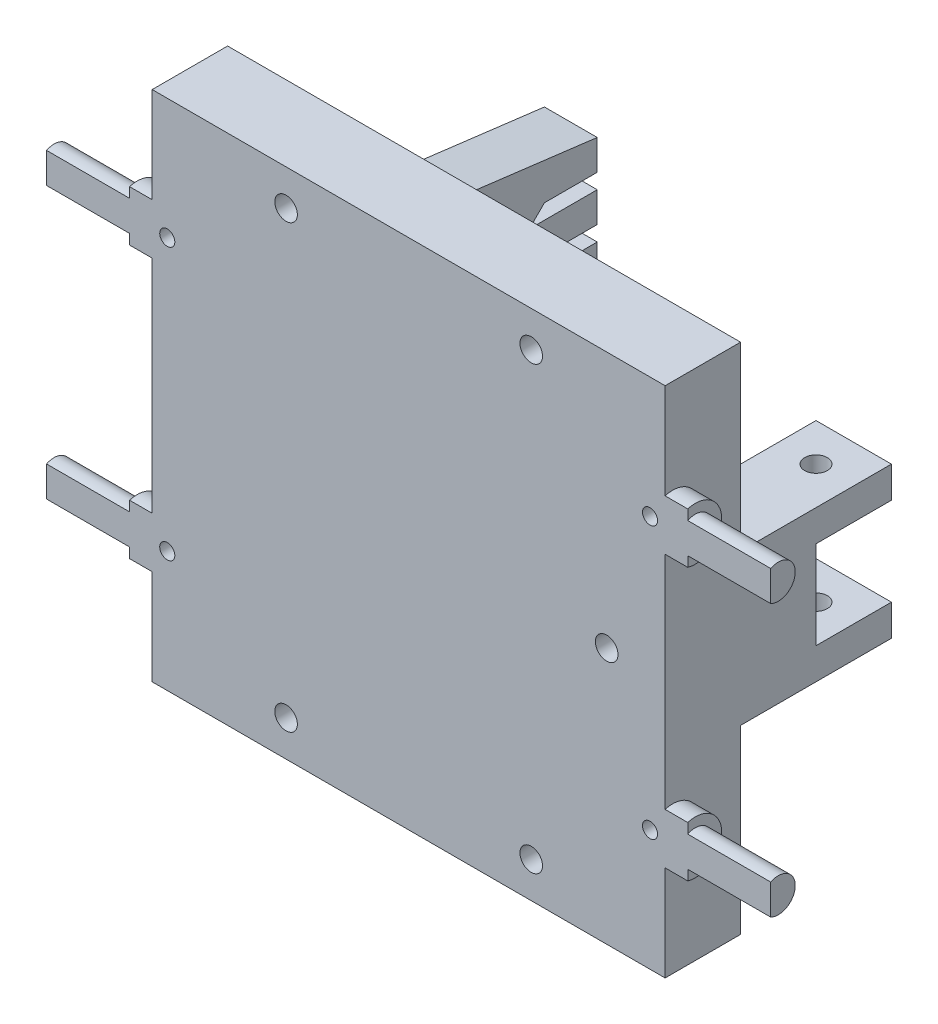
from build123d import *

# Parameters (mm, degrees)
SKETCH1_W           = 68
SKETCH1_H           = 68
BOSS_EXTRUDE1_DEPTH = 10
BOSS_EXTRUDE2_DEPTH = 3
BOSS_EXTRUDE3_DEPTH = 11
BOSS_EXTRUDE4_START = 3
BOSS_EXTRUDE4_DEPTH = 3
BOSS_EXTRUDE5_START = 11
BOSS_EXTRUDE5_DEPTH = 11
SKETCH6_W           = 42.5
SKETCH6_H           = 42.5
CUT_EXTRUDE1_DEPTH  = 3
SKETCH8_R           = 1.5
CUT_EXTRUDE2_DEPTH  = 15
SKETCH9_W           = 10
SKETCH9_H           = 20
BOSS_EXTRUDE6_DEPTH = 20
SKETCH10_R          = 1.5
CUT_EXTRUDE3_DEPTH  = 10
SKETCH11_R          = 1
CUT_EXTRUDE4_DEPTH  = 20
SKETCH13_W          = 7
SKETCH13_H          = 16
BOSS_EXTRUDE7_DEPTH = 40
CUT_EXTRUDE5_DEPTH  = 10
BOSS_EXTRUDE8_START = -7
BOSS_EXTRUDE8_DEPTH = 7
SKETCH17_W          = 10
SKETCH17_H          = 11.7
CUT_EXTRUDE6_DEPTH  = 10
SKETCH18_R          = 1.5
CUT_EXTRUDE7_DEPTH  = 30


with BuildPart() as part:
    # Sketch1 → Boss-Extrude1 (new body)
    with BuildSketch(Plane.XY):
        with Locations((-34, -34)):
            Rectangle(SKETCH1_W, SKETCH1_H)
    extrude(amount=BOSS_EXTRUDE1_DEPTH)

    # Sketch2 → Boss-Extrude2 (add)
    with BuildSketch(Plane.ZY.offset(68)):
        with BuildLine():
            Line((10, -19.354101966), (10, -12.645898034))
            ThreePointArc((10, -12.645898034), (5.5, -16), (10, -19.354101966))
        make_face()
        with BuildLine():
            Line((10, -55.354101966), (10, -48.645898034))
            ThreePointArc((10, -48.645898034), (5.5, -52), (10, -55.354101966))
        make_face()
    extrude(amount=BOSS_EXTRUDE2_DEPTH)

    # Sketch3 → Boss-Extrude3 (add)
    with BuildSketch(Plane.ZY.offset(71)):
        with BuildLine():
            ThreePointArc((10, -49.984435563), (6.75, -52), (10, -54.015564437))
            Line((10, -54.015564437), (10, -49.984435563))
        make_face()
        with BuildLine():
            ThreePointArc((10, -13.984435563), (6.75, -16), (10, -18.015564437))
            Line((10, -18.015564437), (10, -13.984435563))
        make_face()
    extrude(amount=BOSS_EXTRUDE3_DEPTH)

    # Sketch4 → Boss-Extrude4 (add)
    with BuildSketch(Plane(origin=(0, 0, 0), x_dir=(0, 0, -1), z_dir=(1, 0, 0)).offset(BOSS_EXTRUDE4_START)):
        with BuildLine():
            ThreePointArc((-5.5, -16), (-6.908349934, -13.19375696), (-10, -12.645898034))
            Line((-10, -12.645898034), (-10, -19.354101966))
            ThreePointArc((-10, -19.354101966), (-6.908349934, -18.80624304), (-5.5, -16))
        make_face()
        with BuildLine():
            ThreePointArc((-5.5, -52), (-6.908349934, -49.19375696), (-10, -48.645898034))
            Line((-10, -48.645898034), (-10, -55.354101966))
            ThreePointArc((-10, -55.354101966), (-6.908349934, -54.80624304), (-5.5, -52))
        make_face()
    extrude(amount=-BOSS_EXTRUDE4_DEPTH)

    # Sketch5 → Boss-Extrude5 (add)
    with BuildSketch(Plane(origin=(3, 0, 0), x_dir=(0, 0, -1), z_dir=(1, 0, 0)).offset(BOSS_EXTRUDE5_START)):
        with BuildLine():
            ThreePointArc((-6.75, -16), (-7.814145877, -14.087867682), (-10, -13.984435563))
            Line((-10, -13.984435563), (-10, -18.015564437))
            ThreePointArc((-10, -18.015564437), (-7.814145877, -17.912132318), (-6.75, -16))
        make_face()
        with BuildLine():
            ThreePointArc((-6.75, -52), (-7.814145877, -50.087867682), (-10, -49.984435563))
            Line((-10, -49.984435563), (-10, -54.015564437))
            ThreePointArc((-10, -54.015564437), (-7.814145877, -53.912132318), (-6.75, -52))
        make_face()
    extrude(amount=-BOSS_EXTRUDE5_DEPTH)

    # Sketch6 → Cut-Extrude1 (cut)
    with BuildSketch(Plane(origin=(0, 0, 0), x_dir=(-1, 0, 0), z_dir=(0, 0, -1))):
        with Locations((34, -34)):
            Rectangle(SKETCH6_W, SKETCH6_H)
    extrude(amount=-CUT_EXTRUDE1_DEPTH, mode=Mode.SUBTRACT)

    # Sketch8 → Cut-Extrude2 (cut)
    with BuildSketch(Plane(origin=(0, 0, 0), x_dir=(-1, 0, 0), z_dir=(0, 0, -1))):
        with Locations((17.75, -4.75)):
            Circle(SKETCH8_R)
        with Locations((50.25, -4.75)):
            Circle(SKETCH8_R)
        with Locations((50.25, -63.25)):
            Circle(SKETCH8_R)
        with Locations((17.75, -63.25)):
            Circle(SKETCH8_R)
    extrude(amount=-CUT_EXTRUDE2_DEPTH, mode=Mode.SUBTRACT)

    # Sketch9 → Boss-Extrude6 (add)
    with BuildSketch(Plane(origin=(0, 0, 0), x_dir=(-1, 0, 0), z_dir=(0, 0, -1))):
        with Locations((5, -34)):
            Rectangle(SKETCH9_W, SKETCH9_H)
    extrude(amount=BOSS_EXTRUDE6_DEPTH)

    # Sketch10 → Cut-Extrude3 (cut)
    with BuildSketch(Plane(origin=(0, 0, 0), x_dir=(-1, 0, 0), z_dir=(0, 0, -1))):
        with Locations((7.75, -34)):
            Circle(SKETCH10_R)
        with Locations((7.75, -78)):
            Circle(SKETCH10_R)
    extrude(amount=-CUT_EXTRUDE3_DEPTH, mode=Mode.SUBTRACT)

    # Sketch11 → Cut-Extrude4 (cut)
    with BuildSketch(Plane.XY.offset(10)):
        with Locations((-66, -52)):
            Circle(SKETCH11_R)
        with Locations(Location((-66, -16, 0), (0, 0, 180))):
            Circle(SKETCH11_R)
        with Locations(Location((-2, -52, 0), (0, 0, 180))):
            Circle(SKETCH11_R)
        with Locations((-2, -16)):
            Circle(SKETCH11_R)
    extrude(amount=-CUT_EXTRUDE4_DEPTH, mode=Mode.SUBTRACT)

    # Sketch13 → Boss-Extrude7 (add)
    with BuildSketch(Plane(origin=(0, 0, 0), x_dir=(-1, 0, 0), z_dir=(0, 0, -1))):
        with Locations((62.5, -34)):
            Rectangle(SKETCH13_W, SKETCH13_H)
    extrude(amount=BOSS_EXTRUDE7_DEPTH)

    # Sketch15 → Cut-Extrude5 (cut)
    with BuildSketch(Plane.ZY.offset(66)):
        Polygon((-40, -32), (-31, -32), (-33, -30), (-40, -30), align=None)
        Polygon((-40, -38), (-40, -36), (-31, -36), (-33, -38), align=None)
    extrude(amount=-CUT_EXTRUDE5_DEPTH, mode=Mode.SUBTRACT)

    # Sketch16 → Boss-Extrude8 (add)
    with BuildSketch(Plane.ZY.offset(66).offset(BOSS_EXTRUDE8_START)):
        Polygon((0, -26), (-40, -26), (0, -21), align=None)
        Polygon((-40, -42), (0, -47), (0, -42), align=None)
    extrude(amount=BOSS_EXTRUDE8_DEPTH)

    # Sketch17 → Cut-Extrude6 (cut)
    with BuildSketch(Plane(origin=(0, 0, -20), x_dir=(-1, 0, 0), z_dir=(0, 0, -1))):
        with Locations((5, -34)):
            Rectangle(SKETCH17_W, SKETCH17_H)
    extrude(amount=-CUT_EXTRUDE6_DEPTH, mode=Mode.SUBTRACT)

    # Sketch18 → Cut-Extrude7 (cut)
    with BuildSketch(Plane(origin=(0, -44, 0), x_dir=(-1, 0, 0), z_dir=(0, -1, 0))):
        with Locations(Location((5, 15, 0), (0, 0, 180))):
            Circle(SKETCH18_R)
    extrude(amount=-CUT_EXTRUDE7_DEPTH, mode=Mode.SUBTRACT)


solid = part.part
